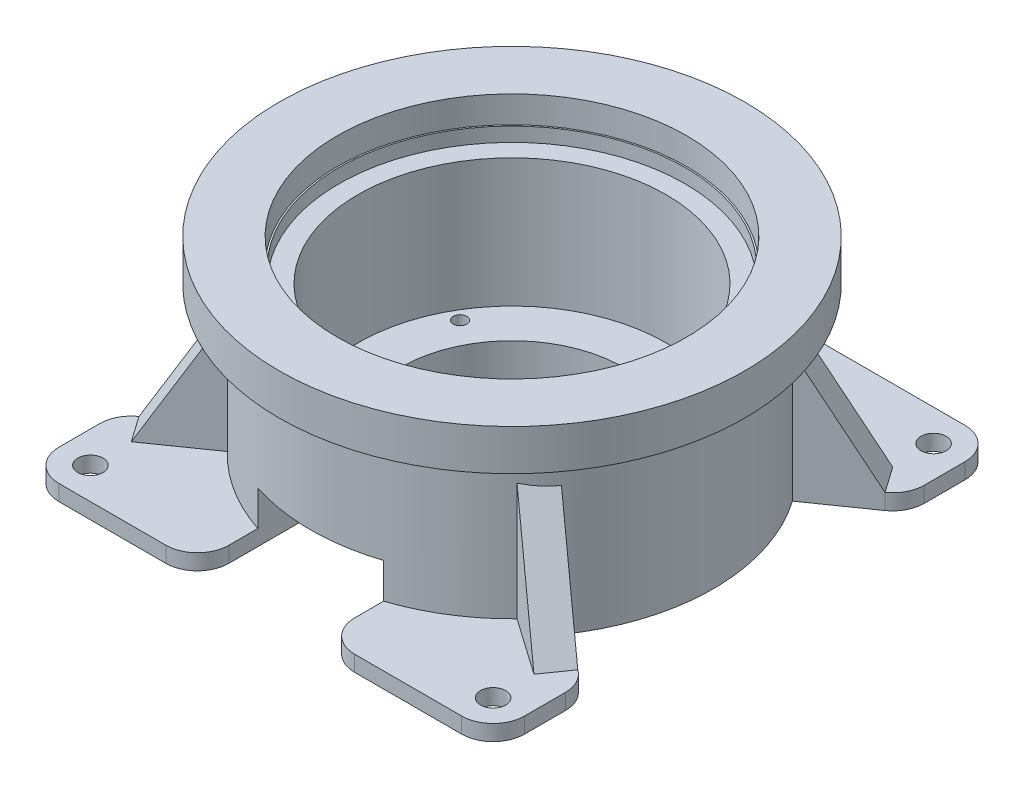
from build123d import *

# Parameters (mm, degrees)
SKETCH_1_R                    = 64
SKETCH_1_R_2                  = 49
EXTRUDE_1_DEPTH               = 52
SKETCH_13_R                   = 49
SKETCH_13_R_2                 = 35.5
EXTRUDE_3_DEPTH               = 11.2
HOLE_WIZARD_M4_11_D           = 4.3
HOLE_WIZARD_M4_11_CBORE_D     = 8
HOLE_WIZARD_M4_11_CBORE_DEPTH = 4.6
SKETCH_18_R                   = 74
SKETCH_18_R_2                 = 56
EXTRUDE_4_DEPTH               = 13
SKETCH_25_R                   = 4
EXTRUDE_7_DEPTH               = 5
SKETCH_28_R                   = 4
EXTRUDE_8_DEPTH               = 5
CUT_EXTRUDE_2_DEPTH           = 81
FILLET_4_R                    = 10
FILLET_5_R                    = 10
RIB_1_REACH                   = 128.89
SKETCH_32_WALL_W              = 297.523252796
SKETCH_32_WALL_H              = 10
RIB_2_REACH                   = 128.89
SKETCH_33_WALL_W              = 297.523252796
SKETCH_33_WALL_H              = 10
RIB_7_REACH                   = 128.89
SKETCH_34_WALL_W              = 297.523252796
SKETCH_34_WALL_H              = 10
RIB_9_REACH                   = 128.89
SKETCH_35_WALL_W              = 297.523252796
SKETCH_35_WALL_H              = 10
SKETCH_36_R                   = 56
SKETCH_36_R_2                 = 55
EXTRUDE_9_DEPTH               = 13
SKETCH_37_R                   = 55.5
CUT_EXTRUDE_3_DEPTH           = 8.5


with BuildPart() as part:
    # 草图1 → 凸台-拉伸1 (new body)
    with BuildSketch(Plane(origin=(0, 0, 0), x_dir=(1, 0, 0), z_dir=(0, 1, 0))):
        with Locations(Location((0, 0, 0), (0, 0, 90))):
            Circle(SKETCH_1_R)
        with Locations(Location((0, 0, 0), (0, 0, 90))):
            Circle(SKETCH_1_R_2, mode=Mode.SUBTRACT)
    extrude(amount=EXTRUDE_1_DEPTH)

    # 草图13 → 凸台-拉伸3 (add)
    with BuildSketch(Plane.XZ):
        with Locations(Location((0, 0, 0), (0, 0, 270))):
            Circle(SKETCH_13_R)
        with Locations(Location((0, 0, 0), (0, 0, 270))):
            Circle(SKETCH_13_R_2, mode=Mode.SUBTRACT)
    extrude(amount=-EXTRUDE_3_DEPTH)

    # M4 六角圆柱头螺钉的柱形沉头孔11 (through all)
    with Locations(Plane.XZ):
        with Locations((-38.980021964, -22.484614467), (38.970883682, -22.50044944), (-38.970883682, 22.50044944), (38.978008551, 22.483453082)):
            CounterBoreHole(HOLE_WIZARD_M4_11_D / 2, HOLE_WIZARD_M4_11_CBORE_D / 2, HOLE_WIZARD_M4_11_CBORE_DEPTH)

    # 草图18 → 凸台-拉伸4 (add)
    with BuildSketch(Plane(origin=(0, 52, 0), x_dir=(1, 0, 0), z_dir=(0, 1, 0))):
        with Locations(Location((0, 0, 0), (0, 0, 90))):
            Circle(SKETCH_18_R)
        with Locations(Location((0, 0, 0), (0, 0, 90))):
            Circle(SKETCH_18_R_2, mode=Mode.SUBTRACT)
    extrude(amount=EXTRUDE_4_DEPTH)

    # 草图25 → 凸台-拉伸7 (add)
    with BuildSketch(Plane.XZ):
        with BuildLine():
            Line((-74, 57.021028333), (-74, 70))
            ThreePointArc((-74, 70), (-71.071067812, 77.071067812), (-64, 80))
            Line((-64, 80), (64, 80))
            ThreePointArc((64, 80), (71.071067812, 77.071067812), (74, 70))
            Line((74, 70), (74, 57.021028333))
            ThreePointArc((74, 57.021028333), (72.870108332, 52.403542201), (69.735764364, 48.82950789))
            Line((69.735764364, 48.82950789), (52.425730834, 36.708891926))
            ThreePointArc((52.425730834, 36.708891926), (0, 64), (-52.425730834, 36.708891926))
            Line((-52.425730834, 36.708891926), (-69.735764364, 48.82950789))
            ThreePointArc((-69.735764364, 48.82950789), (-72.870108332, 52.403542201), (-74, 57.021028333))
        make_face()
        with Locations(Location((-64, 70, 0), (0, 0, 270))):
            Circle(SKETCH_25_R, mode=Mode.SUBTRACT)
        with Locations(Location((64, 70, 0), (0, 0, 270))):
            Circle(SKETCH_25_R, mode=Mode.SUBTRACT)
    extrude(amount=-EXTRUDE_7_DEPTH)

    # 草图28 → 凸台-拉伸8 (add)
    with BuildSketch(Plane.XZ):
        with BuildLine():
            Line((-52.425730834, -36.708891926), (-69.735764364, -48.82950789))
            ThreePointArc((-69.735764364, -48.82950789), (-72.870108332, -52.403542201), (-74, -57.021028333))
            Line((-74, -57.021028333), (-74, -70))
            ThreePointArc((-74, -70), (-71.071067812, -77.071067812), (-64, -80))
            Line((-64, -80), (64, -80))
            ThreePointArc((64, -80), (71.071067812, -77.071067812), (74, -70))
            Line((74, -70), (74, -57.021028333))
            ThreePointArc((74, -57.021028333), (72.870108332, -52.403542201), (69.735764364, -48.82950789))
            Line((69.735764364, -48.82950789), (52.425730834, -36.708891926))
            ThreePointArc((52.425730834, -36.708891926), (0, -64), (-52.425730834, -36.708891926))
        make_face()
        with Locations(Location((-64, -70, 0), (0, 0, 270))):
            Circle(SKETCH_28_R, mode=Mode.SUBTRACT)
        with Locations(Location((64, -70, 0), (0, 0, 270))):
            Circle(SKETCH_28_R, mode=Mode.SUBTRACT)
    extrude(amount=-EXTRUDE_8_DEPTH)

    # 草图14 → 切除-拉伸2 (cut)
    with BuildSketch(Plane.XY):
        Polygon((0, 0), (20, 0), (20, 16.2), (-20, 16.2), (-20, 0), align=None)
    extrude(amount=CUT_EXTRUDE_2_DEPTH, mode=Mode.SUBTRACT)

    # 圆角4
    fillet_4_edges = [part.edges().sort_by_distance(p)[0] for p in [
        (-20, 2.5, 80),
    ]]
    fillet(fillet_4_edges, radius=FILLET_4_R)

    # 圆角5
    fillet_5_edges = [part.edges().sort_by_distance(p)[0] for p in [
        (20, 2.5, 80),
    ]]
    fillet(fillet_5_edges, radius=FILLET_5_R)

    # 草图32 wall → 筋1 (add, up to next)
    with BuildSketch(Plane(origin=(61.080747599, 23, 42.769199908), x_dir=(-0.414672953097, 0.86240308464, -0.290357127642), z_dir=(0.706439249784, 0.506222203783, 0.494654087986)), mode=Mode.PRIVATE) as rib_1_sk1:
        with Locations((0, 5)):
            Rectangle(SKETCH_32_WALL_W, SKETCH_32_WALL_H)
    rib_1_tool1 = extrude(rib_1_sk1.sketch, amount=-RIB_1_REACH, mode=Mode.PRIVATE) - part.part
    add(rib_1_tool1.solids().sort_by_distance((61.080747599, 23, 42.769199908))[0])

    # 草图33 wall → 筋2 (add, up to next)
    with BuildSketch(Plane(origin=(-61.080747599, 23, 42.769199908), x_dir=(-0.414672953097, -0.86240308464, 0.290357127642), z_dir=(-0.706439249784, 0.506222203783, 0.494654087986)), mode=Mode.PRIVATE) as rib_2_sk1:
        with Locations((0, 5)):
            Rectangle(SKETCH_33_WALL_W, SKETCH_33_WALL_H)
    rib_2_tool1 = extrude(rib_2_sk1.sketch, amount=-RIB_2_REACH, mode=Mode.PRIVATE) - part.part
    add(rib_2_tool1.solids().sort_by_distance((-61.080747599, 23, 42.769199908))[0])

    # 草图34 wall → 筋7 (add, up to next)
    with BuildSketch(Plane(origin=(-61.080747599, 23, -42.769199908), x_dir=(0.414672953097, 0.86240308464, 0.290357127642), z_dir=(-0.706439249784, 0.506222203783, -0.494654087986)), mode=Mode.PRIVATE) as rib_7_sk1:
        with Locations((0, 5)):
            Rectangle(SKETCH_34_WALL_W, SKETCH_34_WALL_H)
    rib_7_tool1 = extrude(rib_7_sk1.sketch, amount=-RIB_7_REACH, mode=Mode.PRIVATE) - part.part
    add(rib_7_tool1.solids().sort_by_distance((-61.080747599, 23, -42.769199908))[0])

    # 草图35 wall → 筋9 (add, up to next)
    with BuildSketch(Plane(origin=(61.080747599, 23, -42.769199908), x_dir=(0.414672953097, -0.86240308464, -0.290357127642), z_dir=(0.706439249784, 0.506222203783, -0.494654087986)), mode=Mode.PRIVATE) as rib_9_sk1:
        with Locations((0, 5)):
            Rectangle(SKETCH_35_WALL_W, SKETCH_35_WALL_H)
    rib_9_tool1 = extrude(rib_9_sk1.sketch, amount=-RIB_9_REACH, mode=Mode.PRIVATE) - part.part
    add(rib_9_tool1.solids().sort_by_distance((61.080747599, 23, -42.769199908))[0])

    # 草图36 → 凸台-拉伸9 (add)
    with BuildSketch(Plane(origin=(0, 52, 0), x_dir=(1, 0, 0), z_dir=(0, 1, 0))):
        Circle(SKETCH_36_R)
        with Locations(Location((0, 0, 0), (0, 0, 270))):
            Circle(SKETCH_36_R_2, mode=Mode.SUBTRACT)
    extrude(amount=EXTRUDE_9_DEPTH)

    # 草图37 → 切除-拉伸3 (cut)
    with BuildSketch(Plane(origin=(0, 65, 0), x_dir=(1, 0, 0), z_dir=(0, 1, 0))):
        with Locations(Location((0, 0, 0), (0, 0, 270))):
            Circle(SKETCH_37_R)
    extrude(amount=-CUT_EXTRUDE_3_DEPTH, mode=Mode.SUBTRACT)


solid = part.part
